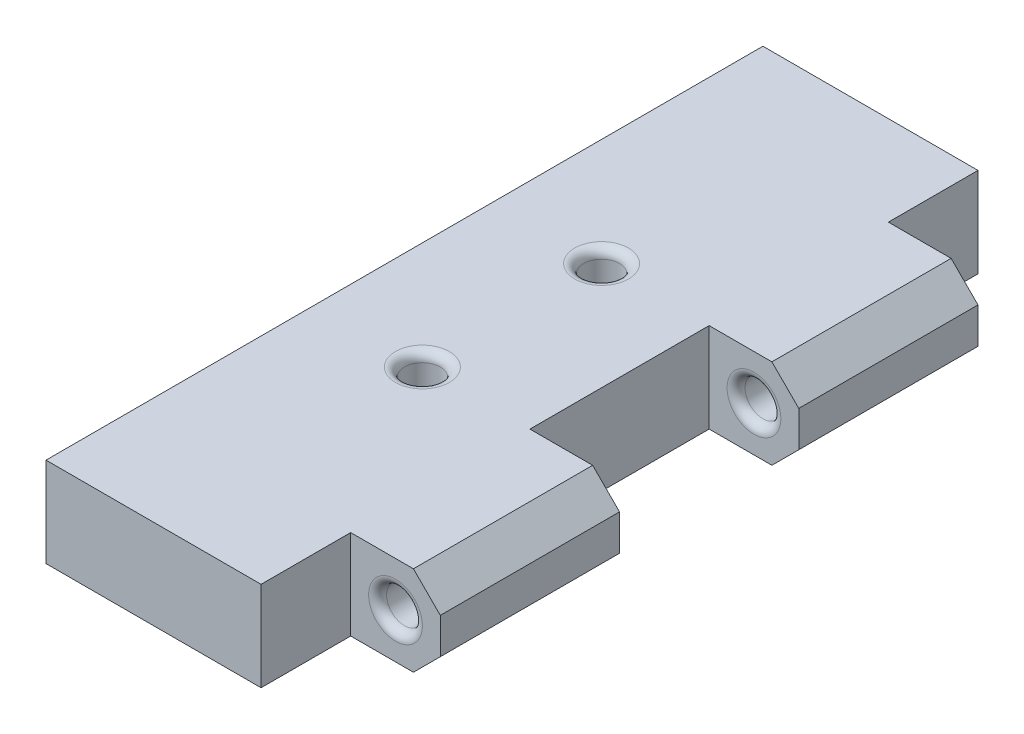
from build123d import *

# Parameters (mm, degrees)
SKETCH1_W             = 12
SKETCH1_H             = 40
SKETCH1_R             = 1
HINGE_DEPTH           = 5
SKETCH2_W             = 10
SKETCH2_H             = 5
HINGE_EXTRUDE_1_DEPTH = 5
HOLE_CUT_1_DEPTH      = 38.027017163
HOLE_CUT_1_DEPTH_BACK = 38.027017163
SKETCH3_R             = 1
FILLET_HOLES_1_R      = 0.5
CHAMFER_1_SIZE        = 1.5


with BuildPart() as part:
    # Sketch1 → Hinge (new body)
    with BuildSketch(Plane(origin=(0, 0, 0), x_dir=(1, 0, 0), z_dir=(0, 1, 0))):
        Rectangle(SKETCH1_W, SKETCH1_H)
        with Locations(Location((0, 5, 0), (0, 0, 270))):
            Circle(SKETCH1_R, mode=Mode.SUBTRACT)
        with Locations(Location((0, -5, 0), (0, 0, 270))):
            Circle(SKETCH1_R, mode=Mode.SUBTRACT)
    extrude(amount=HINGE_DEPTH)

    # Sketch2 → Hinge Extrude 1 (add)
    with BuildSketch(Plane(origin=(6, 0, 0), x_dir=(0, 0, -1), z_dir=(1, 0, 0))):
        with Locations((-10, 2.5)):
            Rectangle(SKETCH2_W, SKETCH2_H)
        with Locations((10, 2.5)):
            Rectangle(SKETCH2_W, SKETCH2_H)
    extrude(amount=HINGE_EXTRUDE_1_DEPTH)

    # Sketch3 → Hole Cut 1 (cut, two sides: drawn at the far end of the back side and taken through both)
    with BuildSketch(Plane(origin=(0, 0, -15), x_dir=(-1, 0, 0), z_dir=(0, 0, -1)).offset(-HOLE_CUT_1_DEPTH_BACK)):
        with Locations((-8.5, 2.5)):
            Circle(SKETCH3_R)
    extrude(amount=HOLE_CUT_1_DEPTH + HOLE_CUT_1_DEPTH_BACK, mode=Mode.SUBTRACT)

    # Fillet Holes 1
    fillet_holes_1_edges = [part.edges().sort_by_distance(p)[0] for p in [
        (0, 0, -6),
        (0, 5, -6),
        (0, 0, 4),
        (0, 5, 4),
        (9.5, 2.5, 5),
        (9.5, 2.5, 15),
        (9.5, 2.5, -15),
        (9.5, 2.5, -5),
    ]]
    fillet(fillet_holes_1_edges, radius=FILLET_HOLES_1_R)

    # Chamfer 1
    chamfer_1_edges = [part.edges().sort_by_distance(p)[0] for p in [
        (11, 0, 10),
        (11, 5, 10),
        (11, 0, -10),
        (11, 5, -10),
    ]]
    chamfer(chamfer_1_edges, length=CHAMFER_1_SIZE)


solid = part.part
